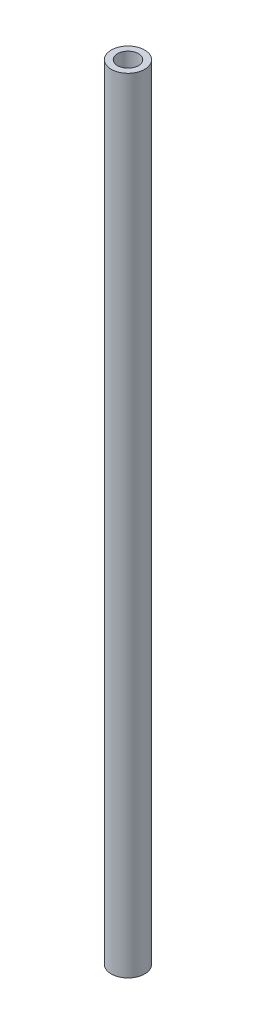
from build123d import *

# Parameters (mm, degrees)
SKETCH1_R           = 3.2
BOSS_EXTRUDE1_DEPTH = 150
SKETCH2_R           = 2
CUT_EXTRUDE1_DEPTH  = 12.5
CUT_EXTRUDE2_START  = -12.5
SKETCH3_R           = 2
CUT_EXTRUDE2_DEPTH  = 12.5


with BuildPart() as part:
    # Sketch1 → Boss-Extrude1 (new body)
    with BuildSketch(Plane(origin=(0, 0, 0), x_dir=(1, 0, 0), z_dir=(0, 1, 0))):
        with Locations(Location((0, 0, 0), (0, 0, 270))):
            Circle(SKETCH1_R)
    extrude(amount=BOSS_EXTRUDE1_DEPTH)

    # Sketch2 → Cut-Extrude1 (cut)
    with BuildSketch(Plane(origin=(0, 150, 0), x_dir=(1, 0, 0), z_dir=(0, 1, 0))):
        with Locations(Location((0, 0, 0), (0, 0, 270))):
            Circle(SKETCH2_R)
    extrude(amount=-CUT_EXTRUDE1_DEPTH, mode=Mode.SUBTRACT)

    # Sketch3 → Cut-Extrude2 (cut)
    with BuildSketch(Plane.XZ.offset(CUT_EXTRUDE2_START)):
        with Locations(Location((0, 0, 0), (0, 0, 90))):
            Circle(SKETCH3_R)
    extrude(amount=CUT_EXTRUDE2_DEPTH, mode=Mode.SUBTRACT)


solid = part.part
